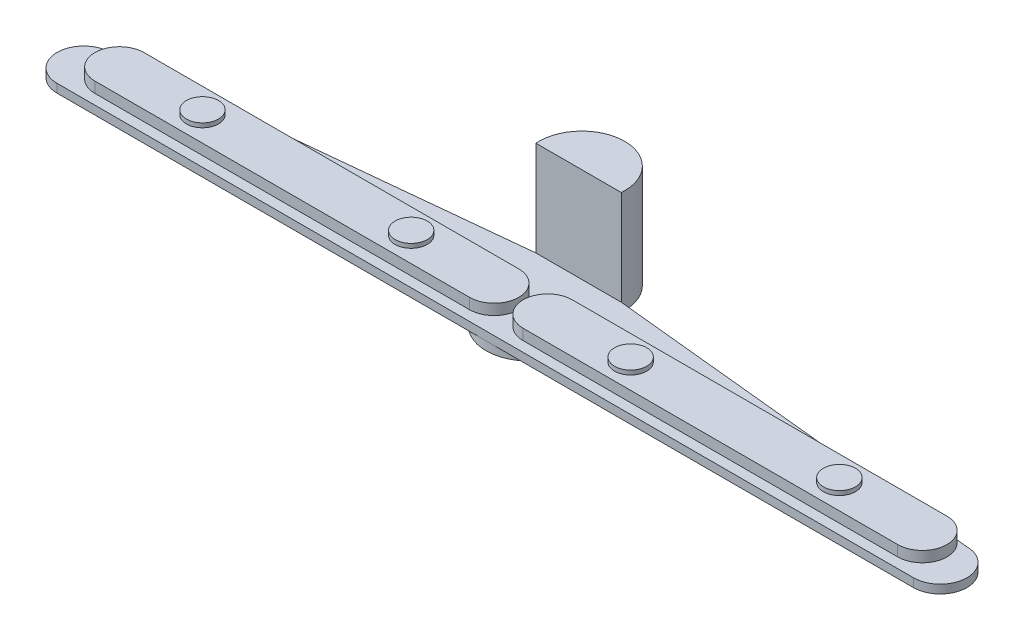
from build123d import *
from build123d.topology import SkipClean

# Parameters (mm, degrees)
BOSS_EXTRUDE1_DEPTH = 40
BOSS_EXTRUDE2_DEPTH = 50
SKETCH3_R           = 75
BOSS_EXTRUDE3_DEPTH = 20
SKETCH4_R           = 200
BOSS_EXTRUDE4_DEPTH = 40
BOSS_EXTRUDE5_DEPTH = 444


with BuildPart() as part:
    # Sketch1 → Boss-Extrude1 (new body)
    with BuildSketch(Plane(origin=(0, 0, 0), x_dir=(1, 0, 0), z_dir=(0, 1, 0))):
        with BuildLine():
            Line((-1446.895354921, -532.23311623), (2553.104645079, -532.23311623))
            ThreePointArc((2553.104645079, -532.23311623), (2678.104643133, -407.21106021), (2553.060533039, -282.233124013))
            Line((2553.060533039, -282.233124013), (756.636813569, -100.229265467))
            ThreePointArc((756.636813569, -100.229265467), (557.196813569, 114.72688377), (357.756813569, -100.229265467))
            Line((357.756813569, -100.229265467), (-1438.639231703, -282.506068524))
            ThreePointArc((-1438.639231703, -282.506068524), (-1571.827098211, -403.102799246), (-1446.895354921, -532.23311623))
        make_face()
    extrude(amount=BOSS_EXTRUDE1_DEPTH)

    # Sketch2 → Boss-Extrude2 (add)
    with BuildSketch(Plane(origin=(0, 40, 0), x_dir=(1, 0, 0), z_dir=(0, 1, 0))):
        with BuildLine():
            Line((682.196813569, -254.73311623), (2432.196813569, -254.73311623))
            ThreePointArc((2432.196813569, -254.73311623), (2547.196813569, -369.73311623), (2432.196813569, -484.73311623))
            Line((2432.196813569, -484.73311623), (682.196813569, -484.73311623))
            ThreePointArc((682.196813569, -484.73311623), (567.196813569, -369.73311623), (682.196813569, -254.73311623))
        make_face()
        with BuildLine():
            Line((432.196813569, -484.73311623), (-1317.803186431, -484.73311623))
            ThreePointArc((-1317.803186431, -484.73311623), (-1432.803186431, -369.73311623), (-1317.803186431, -254.73311623))
            Line((-1317.803186431, -254.73311623), (432.196813569, -254.73311623))
            ThreePointArc((432.196813569, -254.73311623), (547.196813569, -369.73311623), (432.196813569, -484.73311623))
        make_face()
    extrude(amount=BOSS_EXTRUDE2_DEPTH)

    # Sketch3 → Boss-Extrude3 (add)
    with BuildSketch(Plane(origin=(0, 90, 0), x_dir=(1, 0, 0), z_dir=(0, 1, 0))):
        with Locations(Location((-930.303186431, -369.73311623, 0), (0, 0, 270))):
            Circle(SKETCH3_R)
        with Locations(Location((44.696813569, -369.73311623, 0), (0, 0, 270))):
            Circle(SKETCH3_R)
        with Locations(Location((1069.696813569, -369.73311623, 0), (0, 0, 270))):
            Circle(SKETCH3_R)
        with Locations(Location((2044.696813569, -369.73311623, 0), (0, 0, 270))):
            Circle(SKETCH3_R)
    extrude(amount=BOSS_EXTRUDE3_DEPTH)

    # Sketch4 → Boss-Extrude4 (add)
    with BuildSketch(Plane(origin=(0, 0, 0), x_dir=(-1, 0, 0), z_dir=(0, -1, 0))):
        with Locations(Location((-557.196813569, -332.23311623, 0), (0, 0, 270))):
            Circle(SKETCH4_R)
    extrude(amount=BOSS_EXTRUDE4_DEPTH)

    # Sketch5 → Boss-Extrude5 (add)
    with SkipClean():  # the faces are left unmerged after this step: merging them gives an invalid solid
        with BuildSketch(Plane(origin=(0, 40, 0), x_dir=(1, 0, 0), z_dir=(0, 1, 0))):
            with BuildLine():
                Line((756.636813569, -100.229265467), (357.756813569, -100.229265467))
                ThreePointArc((357.756813569, -100.229265467), (557.196813569, 114.72688377), (756.636813569, -100.229265467))
            make_face()
        extrude(amount=BOSS_EXTRUDE5_DEPTH)


solid = part.part
